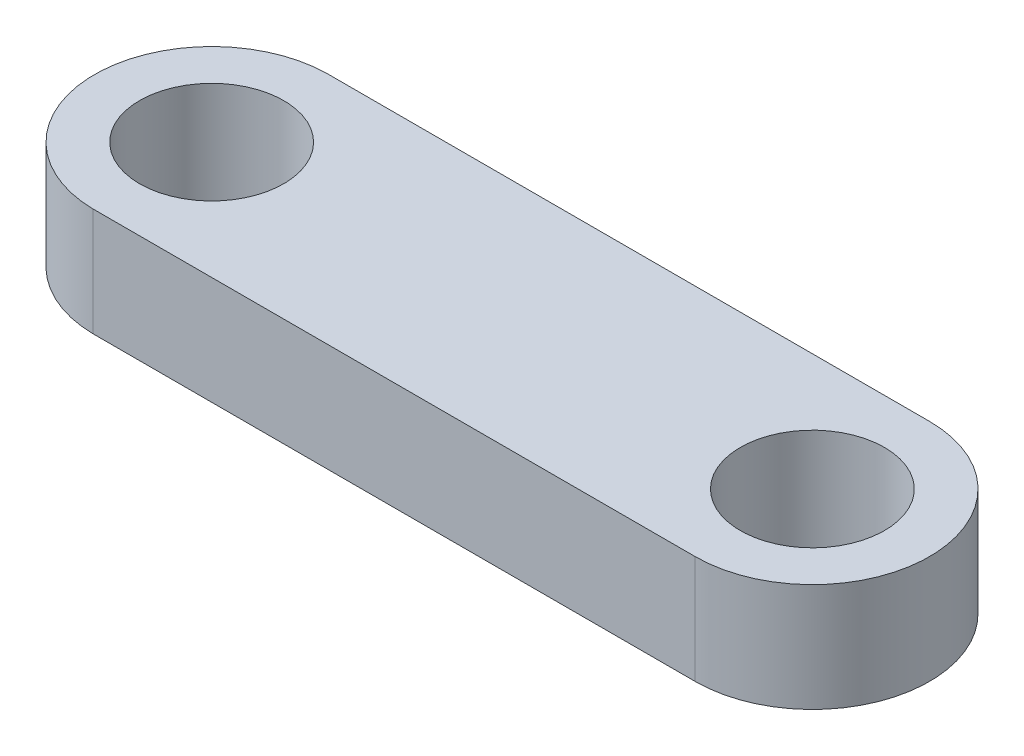
from build123d import *

# Parameters (mm, degrees)
ESQUISSE1_R             = 2.032
BOSS_EXTRU_1_DEPTH      = 3.048
ECHELLE1_SCALE          = 1.5
ESQUISSE2_R             = 3.048
ENL_V_MAT_EXTRU_1_DEPTH = 49.114943513
ESQUISSE3_R             = 3.048
ENL_V_MAT_EXTRU_2_DEPTH = 49.114943513


with BuildPart() as part:
    # Esquisse1 → Boss.-Extru.1 (new body)
    with BuildSketch(Plane(origin=(0, 0, 0), x_dir=(1, 0, 0), z_dir=(0, 1, 0))):
        with BuildLine():
            Line((0, 0), (33.782, 0))
            ThreePointArc((33.782, 0), (37.084, 3.302), (33.782, 6.604))
            Line((33.782, 6.604), (0, 6.604))
            ThreePointArc((0, 6.604), (-3.302, 3.302), (0, 0))
        make_face()
        with Locations(Location((0, 3.302, 0), (0, 0, 90))):
            Circle(ESQUISSE1_R, mode=Mode.SUBTRACT)
        with Locations(Location((33.782, 3.302, 0), (0, 0, 90))):
            Circle(ESQUISSE1_R, mode=Mode.SUBTRACT)
    extrude(amount=BOSS_EXTRU_1_DEPTH)


with BuildPart() as part_1:
    # Echelle1: scaled about (16.891, 1.524, -3.302)
    add(part.part.scale(ECHELLE1_SCALE).moved(Location((-8.4455, -0.762, 1.651))))

    # Esquisse2 → Enlèv. mat.-Extru.1 (cut, through all)
    with BuildSketch(Plane(origin=(0, 3.81, 0), x_dir=(1, 0, 0), z_dir=(0, 1, 0))):
        with Locations(Location((16.8275, 3.302, 0), (0, 0, 270))):
            Circle(ESQUISSE2_R)
    extrude(amount=-ENL_V_MAT_EXTRU_1_DEPTH, mode=Mode.SUBTRACT)

    # Esquisse3 → Enlèv. mat.-Extru.2 (cut, through all)
    # profile 1 of 3: a face of its own
    with BuildSketch(Plane(origin=(0, 3.81, 0), x_dir=(1, 0, 0), z_dir=(0, 1, 0))):
        with BuildLine():
            ThreePointArc((-13.3985, 3.301999981), (-11.947799894, 6.804299881), (-8.4455, 8.255))
            Line((-8.4455, 8.255), (-13.3985, 8.255))
            Line((-13.3985, 8.255), (-13.3985, 3.301999981))
        make_face()
    # profile 2 of 3: a face of its own
    with BuildSketch(Plane(origin=(0, 3.81, 0), x_dir=(1, 0, 0), z_dir=(0, 1, 0))):
        with BuildLine():
            ThreePointArc((-8.4455, -1.651), (-11.947799881, -0.200299894), (-13.3985, 3.301999981))
            Line((-13.3985, 3.301999981), (-13.3985, -1.651))
            Line((-13.3985, -1.651), (-8.4455, -1.651))
        make_face()
    # profile 3 of 3: a face of its own
    with BuildSketch(Plane(origin=(0, 3.81, 0), x_dir=(1, 0, 0), z_dir=(0, 1, 0))):
        with BuildLine():
            Line((16.764, 8.255), (-8.4455, 8.255))
            ThreePointArc((-8.4455, 8.255), (-11.947799894, 6.804299881), (-13.3985, 3.301999981))
            ThreePointArc((-13.3985, 3.301999981), (-11.947799881, -0.200299894), (-8.4455, -1.651))
            Line((-8.4455, -1.651), (16.764, -1.651))
            ThreePointArc((16.764, -1.651), (11.874092965, 3.302), (16.764, 8.255))
        make_face()
        with Locations((-8.4455, 3.302)):
            Circle(ESQUISSE3_R, mode=Mode.SUBTRACT)
    extrude(amount=-ENL_V_MAT_EXTRU_2_DEPTH, mode=Mode.SUBTRACT)


solid = part_1.part
